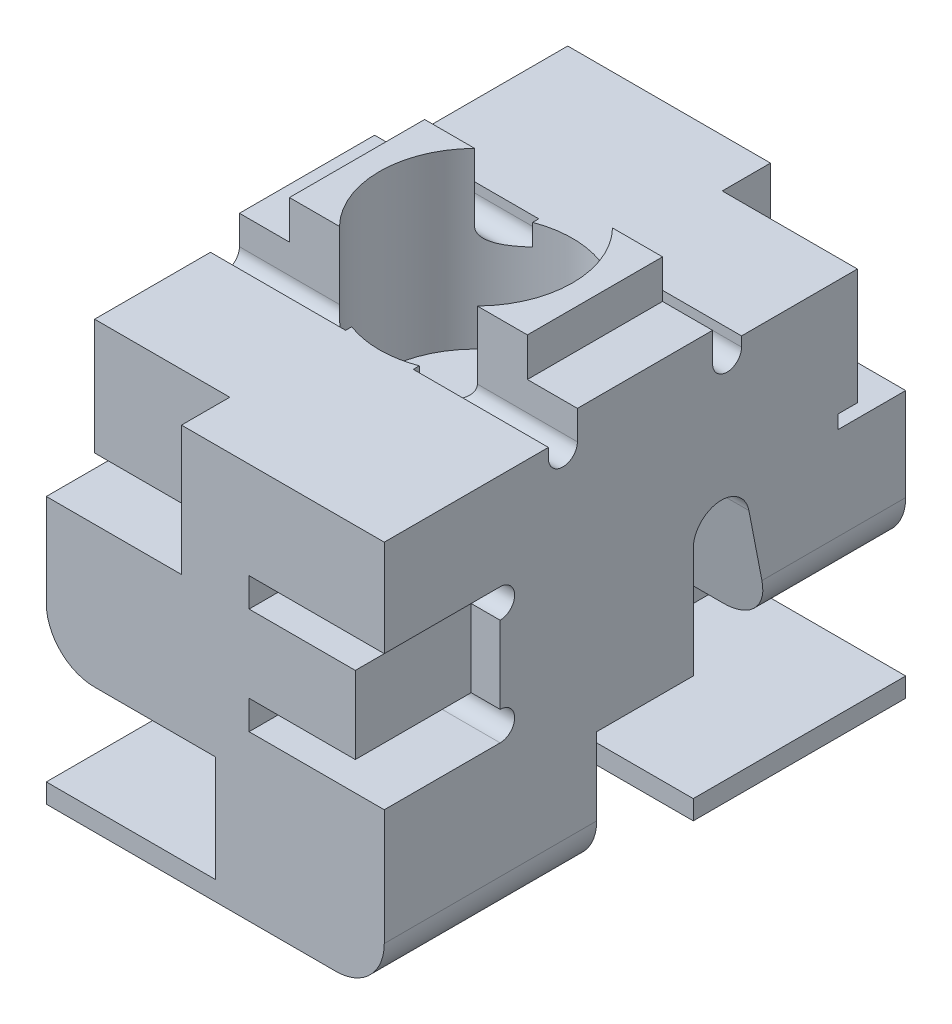
from build123d import *

# Parameters (mm, degrees)
SKETCH1_W           = 4.445
SKETCH1_H           = 6.858
BOSS_EXTRUDE1_DEPTH = 5.461
SKETCH2_R           = 1.27
CUT_EXTRUDE1_DEPTH  = 1.778
SKETCH3_W           = 1.27
SKETCH3_H           = 3.302
CUT_EXTRUDE2_DEPTH  = 10.829176466
CUT_EXTRUDE3_DEPTH  = 2.2225
CUT_EXTRUDE4_DEPTH  = 2.2225
CUT_EXTRUDE6_DEPTH  = 1.778
CUT_EXTRUDE7_START  = -1.778
CUT_EXTRUDE7_DEPTH  = 1.778
FILLET1_R           = 0.635
SKETCH14_W          = 0.889
SKETCH14_H          = 0.254
CUT_EXTRUDE8_DEPTH  = 10.829176567
BOSS_EXTRUDE2_START = 0.508
BOSS_EXTRUDE2_DEPTH = 0.508
SKETCH16_W          = 1.524
SKETCH16_H          = 1.016
CUT_EXTRUDE9_DEPTH  = 0.381
SKETCH17_W          = 1.524
SKETCH17_H          = 1.016
CUT_EXTRUDE10_DEPTH = 0.381


with BuildPart() as part:
    # Sketch1 → Boss-Extrude1 (new body)
    with BuildSketch(Plane(origin=(0, 0, 0), x_dir=(1, 0, 0), z_dir=(0, 1, 0))):
        with Locations((2.2225, 3.429)):
            Rectangle(SKETCH1_W, SKETCH1_H)
    extrude(amount=BOSS_EXTRUDE1_DEPTH)

    # Sketch2 → Cut-Extrude1 (cut)
    with BuildSketch(Plane(origin=(0, 5.461, 0), x_dir=(1, 0, 0), z_dir=(0, 1, 0))):
        with Locations(Location((2.2225, 3.429, 0), (0, 0, 270))):
            Circle(SKETCH2_R)
    extrude(amount=-CUT_EXTRUDE1_DEPTH, mode=Mode.SUBTRACT)

    # Sketch3 → Cut-Extrude2 (cut, through all)
    with BuildSketch(Plane.ZY):
        with Locations((-3.429, 0)):
            Rectangle(SKETCH3_W, SKETCH3_H)
    extrude(amount=-CUT_EXTRUDE2_DEPTH, mode=Mode.SUBTRACT)

    # Sketch4 → Cut-Extrude3 (cut)
    with BuildSketch(Plane.ZY):
        with BuildLine():
            Line((-2.794, 1.651), (-2.794, 3.11311482))
            ThreePointArc((-2.794, 3.11311482), (-2.452929401, 3.467407127), (-2.061869299, 3.169205537))
            Line((-2.061869299, 3.169205537), (-1.767735227, 1.651))
            Line((-1.767735227, 1.651), (0, 1.651))
            Line((0, 1.651), (0, 0.254))
            Line((0, 0.254), (-2.794, 0.254))
            Line((-2.794, 0.254), (-2.794, 1.651))
        make_face()
    extrude(amount=-CUT_EXTRUDE3_DEPTH, mode=Mode.SUBTRACT)

    # Sketch11 → Cut-Extrude4 (cut)
    with BuildSketch(Plane(origin=(4.445, 0, 0), x_dir=(0, 0, -1), z_dir=(1, 0, 0))):
        with BuildLine():
            Line((6.858, 0.254), (6.858, 1.651))
            Line((6.858, 1.651), (5.090264773, 1.651))
            Line((5.090264773, 1.651), (4.796130701, 3.169205537))
            ThreePointArc((4.796130701, 3.169205537), (4.405070599, 3.467407127), (4.064, 3.11311482))
            Line((4.064, 3.11311482), (4.064, 1.651))
            Line((4.064, 1.651), (4.064, 0.254))
            Line((4.064, 0.254), (6.858, 0.254))
        make_face()
    extrude(amount=-CUT_EXTRUDE4_DEPTH, mode=Mode.SUBTRACT)

    # Sketch12 → Cut-Extrude6 (cut)
    with BuildSketch(Plane(origin=(4.445, 0, 0), x_dir=(0, 0, -1), z_dir=(1, 0, 0))):
        with BuildLine():
            Line((0, 2.159), (1.524, 2.159))
            ThreePointArc((1.524, 2.159), (1.7145, 2.3495), (1.524, 2.54))
            Line((1.524, 2.54), (0, 2.54))
            Line((0, 2.54), (0, 2.159))
        make_face()
        with BuildLine():
            Line((0, 3.937), (1.524, 3.937))
            ThreePointArc((1.524, 3.937), (1.7145, 3.7465), (1.524, 3.556))
            Line((1.524, 3.556), (0, 3.556))
            Line((0, 3.556), (0, 3.937))
        make_face()
        with BuildLine():
            Line((2.54, 5.207), (2.54, 5.08))
            ThreePointArc((2.54, 5.08), (2.3495, 4.8895), (2.159, 5.08))
            Line((2.159, 5.08), (2.159, 5.207))
            Line((2.159, 5.207), (0, 5.207))
            Line((0, 5.207), (0, 5.461))
            Line((0, 5.461), (2.54, 5.461))
            Line((2.54, 5.461), (2.54, 5.207))
        make_face()
        with BuildLine():
            Line((4.699, 5.08), (4.699, 5.207))
            Line((4.699, 5.207), (6.223, 5.207))
            Line((6.223, 5.207), (6.223, 3.683))
            Line((6.223, 3.683), (5.969, 3.683))
            Line((5.969, 3.683), (5.969, 3.5052))
            Line((5.969, 3.5052), (6.858, 3.5052))
            Line((6.858, 3.5052), (6.858, 5.461))
            Line((6.858, 5.461), (4.318, 5.461))
            Line((4.318, 5.461), (4.318, 5.207))
            Line((4.318, 5.207), (4.318, 5.08))
            ThreePointArc((4.318, 5.08), (4.5085, 4.8895), (4.699, 5.08))
        make_face()
    extrude(amount=-CUT_EXTRUDE6_DEPTH, mode=Mode.SUBTRACT)

    # Sketch13 → Cut-Extrude7 (cut)
    with BuildSketch(Plane.ZY.offset(CUT_EXTRUDE7_START)):
        with BuildLine():
            Line((-6.858, 2.159), (-5.334, 2.159))
            ThreePointArc((-5.334, 2.159), (-5.1435, 2.3495), (-5.334, 2.54))
            Line((-5.334, 2.54), (-6.858, 2.54))
            Line((-6.858, 2.54), (-6.858, 2.159))
        make_face()
        with BuildLine():
            Line((-6.858, 3.937), (-5.334, 3.937))
            ThreePointArc((-5.334, 3.937), (-5.1435, 3.7465), (-5.334, 3.556))
            Line((-5.334, 3.556), (-6.858, 3.556))
            Line((-6.858, 3.556), (-6.858, 3.937))
        make_face()
        with BuildLine():
            Line((-4.318, 5.207), (-4.318, 5.08))
            ThreePointArc((-4.318, 5.08), (-4.5085, 4.8895), (-4.699, 5.08))
            Line((-4.699, 5.08), (-4.699, 5.207))
            Line((-4.699, 5.207), (-6.858, 5.207))
            Line((-6.858, 5.207), (-6.858, 5.461))
            Line((-6.858, 5.461), (-4.318, 5.461))
            Line((-4.318, 5.461), (-4.318, 5.207))
        make_face()
        with BuildLine():
            Line((-2.159, 5.08), (-2.159, 5.207))
            Line((-2.159, 5.207), (-0.635, 5.207))
            Line((-0.635, 5.207), (-0.635, 3.683))
            Line((-0.635, 3.683), (-0.889, 3.683))
            Line((-0.889, 3.683), (-0.889, 3.5052))
            Line((-0.889, 3.5052), (0, 3.5052))
            Line((0, 3.5052), (0, 5.461))
            Line((0, 5.461), (-2.54, 5.461))
            Line((-2.54, 5.461), (-2.54, 5.207))
            Line((-2.54, 5.207), (-2.54, 5.08))
            ThreePointArc((-2.54, 5.08), (-2.3495, 4.8895), (-2.159, 5.08))
        make_face()
    extrude(amount=CUT_EXTRUDE7_DEPTH, mode=Mode.SUBTRACT)

    # Fillet1
    fillet1_edges = [part.edges().sort_by_distance(p)[0] for p in [
        (0, 1.651, -0.883867613),
        (4.445, 0, -1.397),
        (0, 0, -5.461),
        (4.445, 1.651, -5.974132387),
    ]]
    fillet(fillet1_edges, radius=FILLET1_R)

    # Sketch14 → Cut-Extrude8 (cut, through all)
    with BuildSketch(Plane(origin=(0, 0, -6.858), x_dir=(-1, 0, 0), z_dir=(0, 0, -1))):
        with Locations((-2.2225, 5.334)):
            Rectangle(SKETCH14_W, SKETCH14_H)
    extrude(amount=-CUT_EXTRUDE8_DEPTH, mode=Mode.SUBTRACT)

    # Sketch15 → Boss-Extrude2 (add)
    with BuildSketch(Plane(origin=(0, 5.461, 0), x_dir=(1, 0, 0), z_dir=(0, 1, 0)).offset(BOSS_EXTRUDE2_START)):
        with BuildLine():
            Line((3.12946141, 4.318), (3.787230705, 4.318))
            Line((3.787230705, 4.318), (3.787230705, 2.54))
            Line((3.787230705, 2.54), (3.12946141, 2.54))
            ThreePointArc((3.12946141, 2.54), (3.4925, 3.429), (3.12946141, 4.318))
        make_face()
        with BuildLine():
            Line((1.31553859, 4.318), (0.657769295, 4.318))
            Line((0.657769295, 4.318), (0.657769295, 2.54))
            Line((0.657769295, 2.54), (1.31553859, 2.54))
            ThreePointArc((1.31553859, 2.54), (0.9525, 3.429), (1.31553859, 4.318))
        make_face()
    extrude(amount=-BOSS_EXTRUDE2_DEPTH)

    # Sketch16 → Cut-Extrude9 (cut)
    with BuildSketch(Plane.ZY):
        with Locations((-6.096, 3.048)):
            Rectangle(SKETCH16_W, SKETCH16_H)
    extrude(amount=-CUT_EXTRUDE9_DEPTH, mode=Mode.SUBTRACT)

    # Sketch17 → Cut-Extrude10 (cut)
    with BuildSketch(Plane(origin=(4.445, 0, 0), x_dir=(0, 0, -1), z_dir=(1, 0, 0))):
        with Locations((0.762, 3.048)):
            Rectangle(SKETCH17_W, SKETCH17_H)
    extrude(amount=-CUT_EXTRUDE10_DEPTH, mode=Mode.SUBTRACT)


solid = part.part
